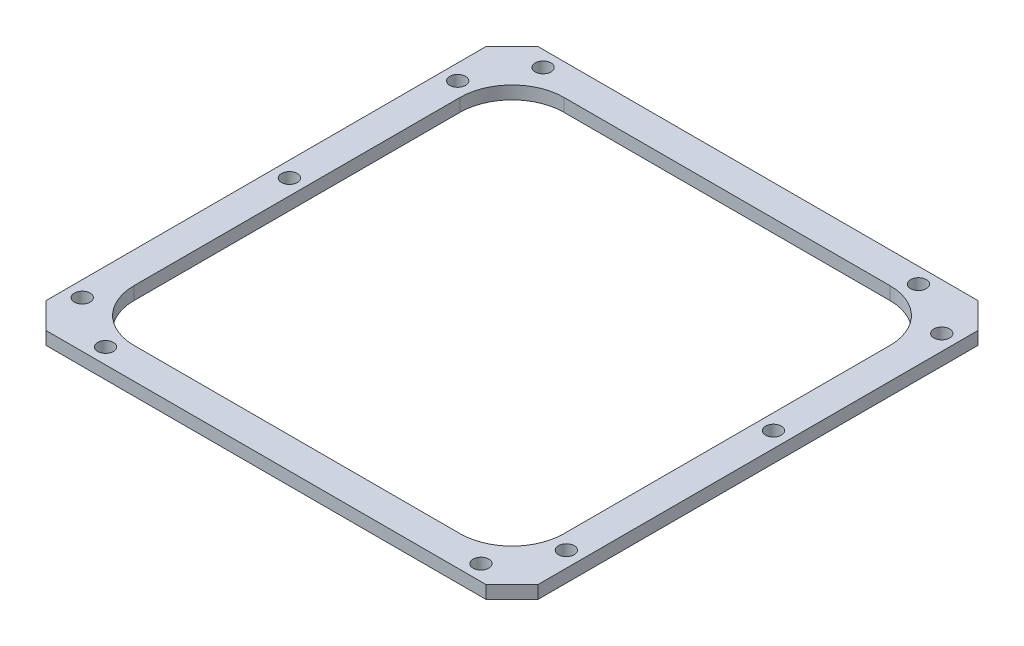
from build123d import *

# Parameters (mm, degrees)
SKETCH1_W           = 190
SKETCH1_H           = 190
BOSS_EXTRUDE1_DEPTH = 5
SKETCH2_W           = 166
SKETCH2_H           = 166
CUT_EXTRUDE1_DEPTH  = 135.443296597
FILLET1_R           = 20
SKETCH3_R           = 3.05
CUT_EXTRUDE2_DEPTH  = 135.443296597
SKETCH4_R           = 3.05
CUT_EXTRUDE3_DEPTH  = 10
CHAMFER1_SIZE       = 10


with BuildPart() as part:
    # Sketch1 → Boss-Extrude1 (new body)
    with BuildSketch(Plane(origin=(0, 0, 0), x_dir=(1, 0, 0), z_dir=(0, 1, 0))):
        Rectangle(SKETCH1_W, SKETCH1_H)
    extrude(amount=BOSS_EXTRUDE1_DEPTH)

    # Sketch2 → Cut-Extrude1 (cut, through all)
    with BuildSketch(Plane(origin=(0, 5, 0), x_dir=(1, 0, 0), z_dir=(0, 1, 0))):
        Rectangle(SKETCH2_W, SKETCH2_H)
    extrude(amount=-CUT_EXTRUDE1_DEPTH, mode=Mode.SUBTRACT)

    # Fillet1
    fillet1_edges = [part.edges().sort_by_distance(p)[0] for p in [
        (83, 2.5, -83),
        (83, 2.5, 83),
        (-83, 2.5, 83),
        (-83, 2.5, -83),
    ]]
    fillet(fillet1_edges, radius=FILLET1_R)

    # Sketch3 → Cut-Extrude2 (cut, through all)
    with BuildSketch(Plane(origin=(0, 5, 0), x_dir=(1, 0, 0), z_dir=(0, 1, 0))):
        with Locations(Location((-77, 89, 0), (0, 0, 270))):
            Circle(SKETCH3_R)
        with Locations(Location((-89, 68, 0), (0, 0, 270))):
            Circle(SKETCH3_R)
        with Locations(Location((89, 77, 0), (0, 0, 270))):
            Circle(SKETCH3_R)
        with Locations(Location((68, 89, 0), (0, 0, 270))):
            Circle(SKETCH3_R)
        with Locations(Location((77, -89, 0), (0, 0, 270))):
            Circle(SKETCH3_R)
        with Locations(Location((89, -68, 0), (0, 0, 270))):
            Circle(SKETCH3_R)
        with Locations(Location((-89, -77, 0), (0, 0, 270))):
            Circle(SKETCH3_R)
        with Locations(Location((-68, -89, 0), (0, 0, 270))):
            Circle(SKETCH3_R)
    extrude(amount=-CUT_EXTRUDE2_DEPTH, mode=Mode.SUBTRACT)

    # Sketch4 → Cut-Extrude3 (cut)
    with BuildSketch(Plane(origin=(0, 5, 0), x_dir=(1, 0, 0), z_dir=(0, 1, 0))):
        with Locations(Location((-89, 3, 0), (0, 0, 270))):
            Circle(SKETCH4_R)
        with Locations(Location((89, 12, 0), (0, 0, 270))):
            Circle(SKETCH4_R)
    extrude(amount=-CUT_EXTRUDE3_DEPTH, mode=Mode.SUBTRACT)

    # Chamfer1
    chamfer1_edges = [part.edges().sort_by_distance(p)[0] for p in [
        (-95, 2.5, -95),
        (-95, 2.5, 95),
        (95, 2.5, 95),
        (95, 2.5, -95),
    ]]
    chamfer(chamfer1_edges, length=CHAMFER1_SIZE)


solid = part.part
